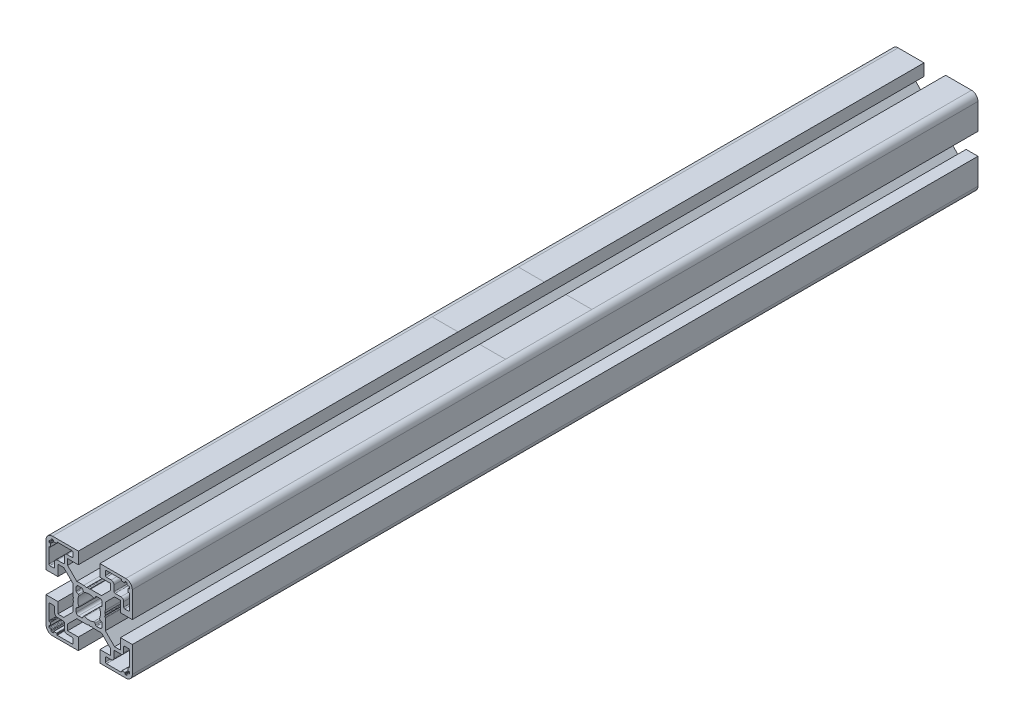
from build123d import *

# Parameters (mm, degrees)
BOSS_EXTRU_1_DEPTH = 392


with BuildPart() as part:
    # Esquisse1 → Boss.-Extru.1 (new body)
    with BuildSketch(Plane.XY.offset(50)):
        with BuildLine():
            Line((-12.564461466, 27.123082583), (-12.564461466, 15.123082583))
            Line((-12.564461466, 15.123082583), (-7.064461466, 15.123082583))
            Line((-7.064461466, 15.123082583), (-7.064461466, 20.123082583))
            Line((-7.064461466, 20.123082583), (-4.332228419, 20.123082583))
            Line((-4.332228419, 20.123082583), (-0.064461466, 15.85531563))
            Line((-0.064461466, 15.85531563), (-0.064461466, 10.776672421))
            ThreePointArc((-0.064461466, 10.776672421), (-0.047424379, 10.647262899), (0.002525832, 10.526672421))
            Line((0.002525832, 10.526672421), (0.235538534, 10.123082583))
            Line((0.235538534, 10.123082583), (0.002525832, 9.719492744))
            ThreePointArc((0.002525832, 9.719492744), (-0.064461466, 9.469492744), (0.002525832, 9.219492744))
            Line((0.002525832, 9.219492744), (0.184561942, 8.904196954))
            Line((0.184561942, 8.904196954), (-0.064461466, 7.623082583))
            Line((-0.064461466, 7.623082583), (-0.064461466, 4.390849536))
            Line((-0.064461466, 4.390849536), (-4.332228419, 0.123082583))
            Line((-4.332228419, 0.123082583), (-7.064461466, 0.123082583))
            Line((-7.064461466, 0.123082583), (-7.064461466, 5.123082583))
            Line((-7.064461466, 5.123082583), (-12.564461466, 5.123082583))
            Line((-12.564461466, 5.123082583), (-12.564461466, -6.876917417))
            ThreePointArc((-12.564461466, -6.876917417), (-11.685781809, -8.998237761), (-9.564461466, -9.876917417))
            Line((-9.564461466, -9.876917417), (2.435538534, -9.876917417))
            Line((2.435538534, -9.876917417), (2.435538534, -4.376917417))
            Line((2.435538534, -4.376917417), (-2.564461466, -4.376917417))
            Line((-2.564461466, -4.376917417), (-2.564461466, -1.64468437))
            Line((-2.564461466, -1.64468437), (1.703305487, 2.623082583))
            Line((1.703305487, 2.623082583), (6.781948696, 2.623082583))
            ThreePointArc((6.781948696, 2.623082583), (6.911358218, 2.640119669), (7.031948696, 2.690069881))
            Line((7.031948696, 2.690069881), (7.435538534, 2.923082583))
            Line((7.435538534, 2.923082583), (7.839128373, 2.690069881))
            ThreePointArc((7.839128373, 2.690069881), (8.089128373, 2.623082583), (8.339128373, 2.690069881))
            Line((8.339128373, 2.690069881), (8.654424163, 2.87210599))
            Line((8.654424163, 2.87210599), (9.935538534, 2.623082583))
            Line((9.935538534, 2.623082583), (13.167771581, 2.623082583))
            Line((13.167771581, 2.623082583), (17.435538534, -1.64468437))
            Line((17.435538534, -1.64468437), (17.435538534, -4.376917417))
            Line((17.435538534, -4.376917417), (12.435538534, -4.376917417))
            Line((12.435538534, -4.376917417), (12.435538534, -9.876917417))
            Line((12.435538534, -9.876917417), (24.435538534, -9.876917417))
            ThreePointArc((24.435538534, -9.876917417), (26.556858878, -8.998237761), (27.435538534, -6.876917417))
            Line((27.435538534, -6.876917417), (27.435538534, 5.123082583))
            Line((27.435538534, 5.123082583), (21.935538534, 5.123082583))
            Line((21.935538534, 5.123082583), (21.935538534, 0.123082583))
            Line((21.935538534, 0.123082583), (19.203305487, 0.123082583))
            Line((19.203305487, 0.123082583), (14.935538534, 4.390849536))
            Line((14.935538534, 4.390849536), (14.935538534, 9.469492744))
            ThreePointArc((14.935538534, 9.469492744), (14.918501447, 9.598902267), (14.868551236, 9.719492744))
            Line((14.868551236, 9.719492744), (14.635538534, 10.123082583))
            Line((14.635538534, 10.123082583), (14.868551236, 10.526672421))
            ThreePointArc((14.868551236, 10.526672421), (14.935538534, 10.776672421), (14.868551236, 11.026672421))
            Line((14.868551236, 11.026672421), (14.686515127, 11.341968211))
            Line((14.686515127, 11.341968211), (14.935538534, 12.623082583))
            Line((14.935538534, 12.623082583), (14.935538534, 15.85531563))
            Line((14.935538534, 15.85531563), (19.203305487, 20.123082583))
            Line((19.203305487, 20.123082583), (21.935538534, 20.123082583))
            Line((21.935538534, 20.123082583), (21.935538534, 15.123082583))
            Line((21.935538534, 15.123082583), (27.435538534, 15.123082583))
            Line((27.435538534, 15.123082583), (27.435538534, 27.123082583))
            ThreePointArc((27.435538534, 27.123082583), (26.556858878, 29.244402926), (24.435538534, 30.123082583))
            Line((24.435538534, 30.123082583), (12.435538534, 30.123082583))
            Line((12.435538534, 30.123082583), (12.435538534, 24.623082583))
            Line((12.435538534, 24.623082583), (17.435538534, 24.623082583))
            Line((17.435538534, 24.623082583), (17.435538534, 21.890849536))
            Line((17.435538534, 21.890849536), (13.167771581, 17.623082583))
            Line((13.167771581, 17.623082583), (8.089128373, 17.623082583))
            ThreePointArc((8.089128373, 17.623082583), (7.95971885, 17.606045496), (7.839128373, 17.556095285))
            Line((7.839128373, 17.556095285), (7.435538534, 17.323082583))
            Line((7.435538534, 17.323082583), (7.031948696, 17.556095285))
            ThreePointArc((7.031948696, 17.556095285), (6.781948696, 17.623082583), (6.531948696, 17.556095285))
            Line((6.531948696, 17.556095285), (6.216652905, 17.374059175))
            Line((6.216652905, 17.374059175), (4.935538534, 17.623082583))
            Line((4.935538534, 17.623082583), (1.703305487, 17.623082583))
            Line((1.703305487, 17.623082583), (-2.564461466, 21.890849536))
            Line((-2.564461466, 21.890849536), (-2.564461466, 24.623082583))
            Line((-2.564461466, 24.623082583), (2.435538534, 24.623082583))
            Line((2.435538534, 24.623082583), (2.435538534, 30.123082583))
            Line((2.435538534, 30.123082583), (-9.564461466, 30.123082583))
            ThreePointArc((-9.564461466, 30.123082583), (-11.685781809, 29.244402926), (-12.564461466, 27.123082583))
        make_face()
        with BuildLine():
            Line((-11.264461466, -4.676917417), (-11.264461466, 2.123082583))
            ThreePointArc((-11.264461466, 2.123082583), (-11.118014856, 2.476635973), (-10.764461466, 2.623082583))
            Line((-10.764461466, 2.623082583), (-9.064461466, 2.623082583))
            ThreePointArc((-9.064461466, 2.623082583), (-8.710908075, 2.476635973), (-8.564461466, 2.123082583))
            Line((-8.564461466, 2.123082583), (-8.564461466, -0.076917417))
            ThreePointArc((-8.564461466, -0.076917417), (-8.183700281, -0.996156233), (-7.264461466, -1.376917417))
            Line((-7.264461466, -1.376917417), (-4.564461466, -1.376917417))
            ThreePointArc((-4.564461466, -1.376917417), (-4.210908075, -1.523364027), (-4.064461466, -1.876917417))
            Line((-4.064461466, -1.876917417), (-4.064461466, -4.576917417))
            ThreePointArc((-4.064461466, -4.576917417), (-3.683700281, -5.496156233), (-2.764461466, -5.876917417))
            Line((-2.764461466, -5.876917417), (-0.564461466, -5.876917417))
            ThreePointArc((-0.564461466, -5.876917417), (-0.210908075, -6.023364027), (-0.064461466, -6.376917417))
            Line((-0.064461466, -6.376917417), (-0.064461466, -8.076917417))
            ThreePointArc((-0.064461466, -8.076917417), (-0.210908075, -8.430470808), (-0.564461466, -8.576917417))
            Line((-0.564461466, -8.576917417), (-7.364461466, -8.576917417))
            ThreePointArc((-7.364461466, -8.576917417), (-7.505882822, -8.518338774), (-7.564461466, -8.376917417))
            Line((-7.564461466, -8.376917417), (-7.564461466, -8.076917417))
            ThreePointArc((-7.564461466, -8.076917417), (-7.62304011, -7.935496061), (-7.764461466, -7.876917417))
            Line((-7.764461466, -7.876917417), (-8.964461466, -7.876917417))
            ThreePointArc((-8.964461466, -7.876917417), (-9.105882822, -7.935496061), (-9.164461466, -8.076917417))
            Line((-9.164461466, -8.076917417), (-9.164461466, -8.376917417))
            ThreePointArc((-9.164461466, -8.376917417), (-9.22304011, -8.518338774), (-9.364461466, -8.576917417))
            Line((-9.364461466, -8.576917417), (-9.864461466, -8.576917417))
            ThreePointArc((-9.864461466, -8.576917417), (-10.0765935, -8.489049452), (-10.164461466, -8.276917417))
            Line((-10.164461466, -8.276917417), (-10.164461466, -7.776917417))
            ThreePointArc((-10.164461466, -7.776917417), (-10.252329431, -7.564785383), (-10.464461466, -7.476917417))
            Line((-10.464461466, -7.476917417), (-10.964461466, -7.476917417))
            ThreePointArc((-10.964461466, -7.476917417), (-11.1765935, -7.389049452), (-11.264461466, -7.176917417))
            Line((-11.264461466, -7.176917417), (-11.264461466, -6.676917417))
            ThreePointArc((-11.264461466, -6.676917417), (-11.205882822, -6.535496061), (-11.064461466, -6.476917417))
            Line((-11.064461466, -6.476917417), (-10.764461466, -6.476917417))
            ThreePointArc((-10.764461466, -6.476917417), (-10.62304011, -6.418338774), (-10.564461466, -6.276917417))
            Line((-10.564461466, -6.276917417), (-10.564461466, -5.076917417))
            ThreePointArc((-10.564461466, -5.076917417), (-10.62304011, -4.935496061), (-10.764461466, -4.876917417))
            Line((-10.764461466, -4.876917417), (-11.064461466, -4.876917417))
            ThreePointArc((-11.064461466, -4.876917417), (-11.205882822, -4.818338774), (-11.264461466, -4.676917417))
        make_face(mode=Mode.SUBTRACT)
        with BuildLine():
            Line((14.935538534, -8.076917417), (14.935538534, -6.376917417))
            ThreePointArc((14.935538534, -6.376917417), (15.081985144, -6.023364027), (15.435538534, -5.876917417))
            Line((15.435538534, -5.876917417), (17.635538534, -5.876917417))
            ThreePointArc((17.635538534, -5.876917417), (18.55477735, -5.496156233), (18.935538534, -4.576917417))
            Line((18.935538534, -4.576917417), (18.935538534, -1.876917417))
            ThreePointArc((18.935538534, -1.876917417), (19.081985144, -1.523364027), (19.435538534, -1.376917417))
            Line((19.435538534, -1.376917417), (22.135538534, -1.376917417))
            ThreePointArc((22.135538534, -1.376917417), (23.05477735, -0.996156233), (23.435538534, -0.076917417))
            Line((23.435538534, -0.076917417), (23.435538534, 2.123082583))
            ThreePointArc((23.435538534, 2.123082583), (23.581985144, 2.476635973), (23.935538534, 2.623082583))
            Line((23.935538534, 2.623082583), (25.635538534, 2.623082583))
            ThreePointArc((25.635538534, 2.623082583), (25.989091925, 2.476635973), (26.135538534, 2.123082583))
            Line((26.135538534, 2.123082583), (26.135538534, -4.676917417))
            ThreePointArc((26.135538534, -4.676917417), (26.07695989, -4.818338774), (25.935538534, -4.876917417))
            Line((25.935538534, -4.876917417), (25.635538534, -4.876917417))
            ThreePointArc((25.635538534, -4.876917417), (25.494117178, -4.935496061), (25.435538534, -5.076917417))
            Line((25.435538534, -5.076917417), (25.435538534, -6.276917417))
            ThreePointArc((25.435538534, -6.276917417), (25.494117178, -6.418338774), (25.635538534, -6.476917417))
            Line((25.635538534, -6.476917417), (25.935538534, -6.476917417))
            ThreePointArc((25.935538534, -6.476917417), (26.07695989, -6.535496061), (26.135538534, -6.676917417))
            Line((26.135538534, -6.676917417), (26.135538534, -7.176917417))
            ThreePointArc((26.135538534, -7.176917417), (26.047670569, -7.389049452), (25.835538534, -7.476917417))
            Line((25.835538534, -7.476917417), (25.335538534, -7.476917417))
            ThreePointArc((25.335538534, -7.476917417), (25.1234065, -7.564785383), (25.035538534, -7.776917417))
            Line((25.035538534, -7.776917417), (25.035538534, -8.276917417))
            ThreePointArc((25.035538534, -8.276917417), (24.947670569, -8.489049452), (24.735538534, -8.576917417))
            Line((24.735538534, -8.576917417), (24.235538534, -8.576917417))
            ThreePointArc((24.235538534, -8.576917417), (24.094117178, -8.518338774), (24.035538534, -8.376917417))
            Line((24.035538534, -8.376917417), (24.035538534, -8.076917417))
            ThreePointArc((24.035538534, -8.076917417), (23.97695989, -7.935496061), (23.835538534, -7.876917417))
            Line((23.835538534, -7.876917417), (22.635538534, -7.876917417))
            ThreePointArc((22.635538534, -7.876917417), (22.494117178, -7.935496061), (22.435538534, -8.076917417))
            Line((22.435538534, -8.076917417), (22.435538534, -8.376917417))
            ThreePointArc((22.435538534, -8.376917417), (22.37695989, -8.518338774), (22.235538534, -8.576917417))
            Line((22.235538534, -8.576917417), (15.435538534, -8.576917417))
            ThreePointArc((15.435538534, -8.576917417), (15.081985144, -8.430470808), (14.935538534, -8.076917417))
        make_face(mode=Mode.SUBTRACT)
        with BuildLine():
            Line((14.935538534, 26.623082583), (14.935538534, 28.323082583))
            ThreePointArc((14.935538534, 28.323082583), (15.081985144, 28.676635973), (15.435538534, 28.823082583))
            Line((15.435538534, 28.823082583), (22.235538534, 28.823082583))
            ThreePointArc((22.235538534, 28.823082583), (22.37695989, 28.764503939), (22.435538534, 28.623082583))
            Line((22.435538534, 28.623082583), (22.435538534, 28.323082583))
            ThreePointArc((22.435538534, 28.323082583), (22.494117178, 28.181661226), (22.635538534, 28.123082583))
            Line((22.635538534, 28.123082583), (23.835538534, 28.123082583))
            ThreePointArc((23.835538534, 28.123082583), (23.97695989, 28.181661226), (24.035538534, 28.323082583))
            Line((24.035538534, 28.323082583), (24.035538534, 28.623082583))
            ThreePointArc((24.035538534, 28.623082583), (24.094117178, 28.764503939), (24.235538534, 28.823082583))
            Line((24.235538534, 28.823082583), (24.735538534, 28.823082583))
            ThreePointArc((24.735538534, 28.823082583), (24.947670569, 28.735214617), (25.035538534, 28.523082583))
            Line((25.035538534, 28.523082583), (25.035538534, 28.023082583))
            ThreePointArc((25.035538534, 28.023082583), (25.1234065, 27.810950548), (25.335538534, 27.723082583))
            Line((25.335538534, 27.723082583), (25.835538534, 27.723082583))
            ThreePointArc((25.835538534, 27.723082583), (26.047670569, 27.635214617), (26.135538534, 27.423082583))
            Line((26.135538534, 27.423082583), (26.135538534, 26.923082583))
            ThreePointArc((26.135538534, 26.923082583), (26.07695989, 26.781661226), (25.935538534, 26.723082583))
            Line((25.935538534, 26.723082583), (25.635538534, 26.723082583))
            ThreePointArc((25.635538534, 26.723082583), (25.494117178, 26.664503939), (25.435538534, 26.523082583))
            Line((25.435538534, 26.523082583), (25.435538534, 25.323082583))
            ThreePointArc((25.435538534, 25.323082583), (25.494117178, 25.181661226), (25.635538534, 25.123082583))
            Line((25.635538534, 25.123082583), (25.935538534, 25.123082583))
            ThreePointArc((25.935538534, 25.123082583), (26.07695989, 25.064503939), (26.135538534, 24.923082583))
            Line((26.135538534, 24.923082583), (26.135538534, 18.123082583))
            ThreePointArc((26.135538534, 18.123082583), (25.989091925, 17.769529192), (25.635538534, 17.623082583))
            Line((25.635538534, 17.623082583), (23.935538534, 17.623082583))
            ThreePointArc((23.935538534, 17.623082583), (23.581985144, 17.769529192), (23.435538534, 18.123082583))
            Line((23.435538534, 18.123082583), (23.435538534, 20.323082583))
            ThreePointArc((23.435538534, 20.323082583), (23.05477735, 21.242321398), (22.135538534, 21.623082583))
            Line((22.135538534, 21.623082583), (19.435538534, 21.623082583))
            ThreePointArc((19.435538534, 21.623082583), (19.081985144, 21.769529192), (18.935538534, 22.123082583))
            Line((18.935538534, 22.123082583), (18.935538534, 24.823082583))
            ThreePointArc((18.935538534, 24.823082583), (18.55477735, 25.742321398), (17.635538534, 26.123082583))
            Line((17.635538534, 26.123082583), (15.435538534, 26.123082583))
            ThreePointArc((15.435538534, 26.123082583), (15.081985144, 26.269529192), (14.935538534, 26.623082583))
        make_face(mode=Mode.SUBTRACT)
        with BuildLine():
            Line((-11.264461466, 18.123082583), (-11.264461466, 24.923082583))
            ThreePointArc((-11.264461466, 24.923082583), (-11.205882822, 25.064503939), (-11.064461466, 25.123082583))
            Line((-11.064461466, 25.123082583), (-10.764461466, 25.123082583))
            ThreePointArc((-10.764461466, 25.123082583), (-10.62304011, 25.181661226), (-10.564461466, 25.323082583))
            Line((-10.564461466, 25.323082583), (-10.564461466, 26.523082583))
            ThreePointArc((-10.564461466, 26.523082583), (-10.62304011, 26.664503939), (-10.764461466, 26.723082583))
            Line((-10.764461466, 26.723082583), (-11.064461466, 26.723082583))
            ThreePointArc((-11.064461466, 26.723082583), (-11.205882822, 26.781661226), (-11.264461466, 26.923082583))
            Line((-11.264461466, 26.923082583), (-11.264461466, 27.423082583))
            ThreePointArc((-11.264461466, 27.423082583), (-11.1765935, 27.635214617), (-10.964461466, 27.723082583))
            Line((-10.964461466, 27.723082583), (-10.464461466, 27.723082583))
            ThreePointArc((-10.464461466, 27.723082583), (-10.252329431, 27.810950548), (-10.164461466, 28.023082583))
            Line((-10.164461466, 28.023082583), (-10.164461466, 28.523082583))
            ThreePointArc((-10.164461466, 28.523082583), (-10.0765935, 28.735214617), (-9.864461466, 28.823082583))
            Line((-9.864461466, 28.823082583), (-9.364461466, 28.823082583))
            ThreePointArc((-9.364461466, 28.823082583), (-9.22304011, 28.764503939), (-9.164461466, 28.623082583))
            Line((-9.164461466, 28.623082583), (-9.164461466, 28.323082583))
            ThreePointArc((-9.164461466, 28.323082583), (-9.105882822, 28.181661226), (-8.964461466, 28.123082583))
            Line((-8.964461466, 28.123082583), (-7.764461466, 28.123082583))
            ThreePointArc((-7.764461466, 28.123082583), (-7.62304011, 28.181661226), (-7.564461466, 28.323082583))
            Line((-7.564461466, 28.323082583), (-7.564461466, 28.623082583))
            ThreePointArc((-7.564461466, 28.623082583), (-7.505882822, 28.764503939), (-7.364461466, 28.823082583))
            Line((-7.364461466, 28.823082583), (-0.564461466, 28.823082583))
            ThreePointArc((-0.564461466, 28.823082583), (-0.210908075, 28.676635973), (-0.064461466, 28.323082583))
            Line((-0.064461466, 28.323082583), (-0.064461466, 26.623082583))
            ThreePointArc((-0.064461466, 26.623082583), (-0.210908075, 26.269529192), (-0.564461466, 26.123082583))
            Line((-0.564461466, 26.123082583), (-2.764461466, 26.123082583))
            ThreePointArc((-2.764461466, 26.123082583), (-3.683700281, 25.742321398), (-4.064461466, 24.823082583))
            Line((-4.064461466, 24.823082583), (-4.064461466, 22.123082583))
            ThreePointArc((-4.064461466, 22.123082583), (-4.210908075, 21.769529192), (-4.564461466, 21.623082583))
            Line((-4.564461466, 21.623082583), (-7.264461466, 21.623082583))
            ThreePointArc((-7.264461466, 21.623082583), (-8.183700281, 21.242321398), (-8.564461466, 20.323082583))
            Line((-8.564461466, 20.323082583), (-8.564461466, 18.123082583))
            ThreePointArc((-8.564461466, 18.123082583), (-8.710908075, 17.769529192), (-9.064461466, 17.623082583))
            Line((-9.064461466, 17.623082583), (-10.764461466, 17.623082583))
            ThreePointArc((-10.764461466, 17.623082583), (-11.118014856, 17.769529192), (-11.264461466, 18.123082583))
        make_face(mode=Mode.SUBTRACT)
        with BuildLine():
            Line((10.926225434, 16.123082583), (12.435538534, 16.123082583))
            ThreePointArc((12.435538534, 16.123082583), (13.142645315, 15.830189364), (13.435538534, 15.123082583))
            Line((13.435538534, 15.123082583), (13.435538534, 13.613769482))
            ThreePointArc((13.435538534, 13.613769482), (13.364122185, 13.356250445), (13.170274316, 13.172295686))
            Line((13.170274316, 13.172295686), (12.493256258, 12.812318799))
            ThreePointArc((12.493256258, 12.812318799), (12.256654607, 12.537701304), (12.267778691, 12.175387401))
            ThreePointArc((12.267778691, 12.175387401), (12.685538534, 10.123082583), (12.267778691, 8.070777764))
            ThreePointArc((12.267778691, 8.070777764), (12.256654607, 7.708463861), (12.493256258, 7.433846366))
            Line((12.493256258, 7.433846366), (13.170274316, 7.07386948))
            ThreePointArc((13.170274316, 7.07386948), (13.364122185, 6.889914721), (13.435538534, 6.632395683))
            Line((13.435538534, 6.632395683), (13.435538534, 5.123082583))
            ThreePointArc((13.435538534, 5.123082583), (13.142645315, 4.415975801), (12.435538534, 4.123082583))
            Line((12.435538534, 4.123082583), (10.926225434, 4.123082583))
            ThreePointArc((10.926225434, 4.123082583), (10.668706396, 4.194498932), (10.484751637, 4.388346801))
            Line((10.484751637, 4.388346801), (10.124774751, 5.065364859))
            ThreePointArc((10.124774751, 5.065364859), (9.850157255, 5.301966509), (9.487843352, 5.290842426))
            ThreePointArc((9.487843352, 5.290842426), (7.435538534, 4.873082583), (5.383233716, 5.290842426))
            ThreePointArc((5.383233716, 5.290842426), (5.020919813, 5.301966509), (4.746302318, 5.065364859))
            Line((4.746302318, 5.065364859), (4.386325431, 4.388346801))
            ThreePointArc((4.386325431, 4.388346801), (4.202370672, 4.194498932), (3.944851635, 4.123082583))
            Line((3.944851635, 4.123082583), (2.435538534, 4.123082583))
            ThreePointArc((2.435538534, 4.123082583), (1.728431753, 4.415975801), (1.435538534, 5.123082583))
            Line((1.435538534, 5.123082583), (1.435538534, 6.632395683))
            ThreePointArc((1.435538534, 6.632395683), (1.506954884, 6.889914721), (1.700802753, 7.07386948))
            Line((1.700802753, 7.07386948), (2.37782081, 7.433846366))
            ThreePointArc((2.37782081, 7.433846366), (2.614422461, 7.708463861), (2.603298377, 8.070777764))
            ThreePointArc((2.603298377, 8.070777764), (2.185538534, 10.123082583), (2.603298377, 12.175387401))
            ThreePointArc((2.603298377, 12.175387401), (2.614422461, 12.537701304), (2.37782081, 12.812318799))
            Line((2.37782081, 12.812318799), (1.700802753, 13.172295686))
            ThreePointArc((1.700802753, 13.172295686), (1.506954884, 13.356250445), (1.435538534, 13.613769482))
            Line((1.435538534, 13.613769482), (1.435538534, 15.123082583))
            ThreePointArc((1.435538534, 15.123082583), (1.728431753, 15.830189364), (2.435538534, 16.123082583))
            Line((2.435538534, 16.123082583), (3.944851635, 16.123082583))
            ThreePointArc((3.944851635, 16.123082583), (4.202370672, 16.051666233), (4.386325431, 15.857818364))
            Line((4.386325431, 15.857818364), (4.746302318, 15.180800306))
            ThreePointArc((4.746302318, 15.180800306), (5.020919813, 14.944198656), (5.383233716, 14.955322739))
            ThreePointArc((5.383233716, 14.955322739), (7.435538534, 15.373082583), (9.487843352, 14.955322739))
            ThreePointArc((9.487843352, 14.955322739), (9.850157255, 14.944198656), (10.124774751, 15.180800306))
            Line((10.124774751, 15.180800306), (10.484751637, 15.857818364))
            ThreePointArc((10.484751637, 15.857818364), (10.668706396, 16.051666233), (10.926225434, 16.123082583))
        make_face(mode=Mode.SUBTRACT)
    extrude(amount=-BOSS_EXTRU_1_DEPTH)


solid = part.part
